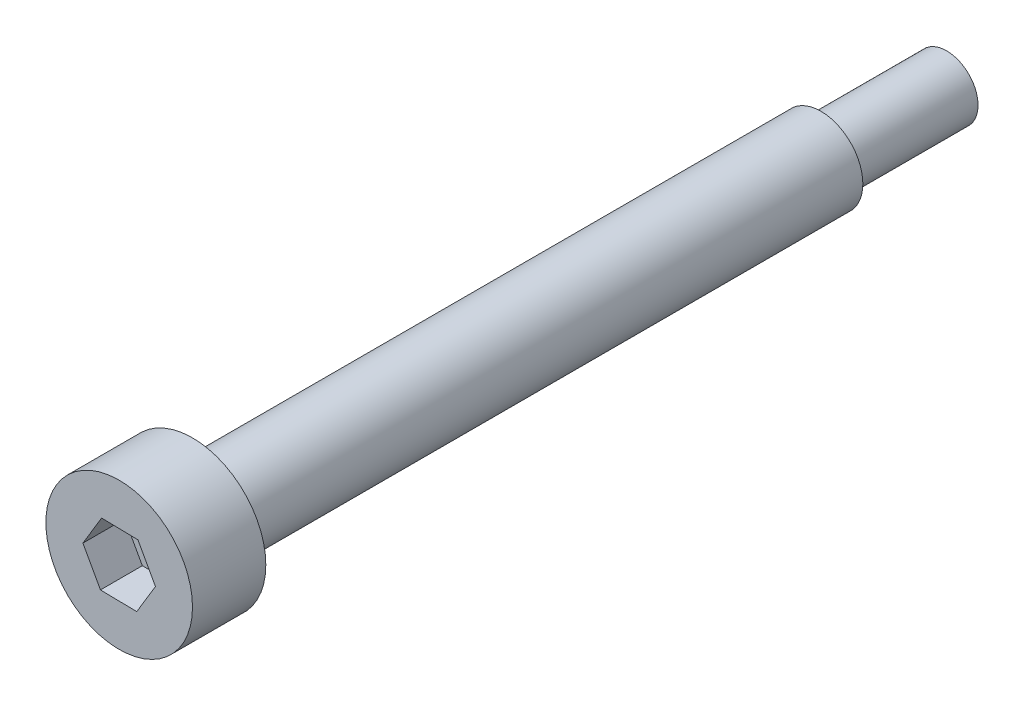
from build123d import *

# Parameters (mm, degrees)
SKETCH_1_R          = 3.5
EXTRUDE_1_DEPTH     = 3.5
CUT_EXTRUDE_1_DEPTH = 2
SKETCH_3_R          = 2
EXTRUDE_2_DEPTH     = 30
SKETCH_4_R          = 1.5
EXTRUDE_3_DEPTH     = 6


with BuildPart() as part:
    # 草图1 → 凸台-拉伸1 (new body)
    with BuildSketch(Plane.XY):
        Circle(SKETCH_1_R)
    extrude(amount=EXTRUDE_1_DEPTH)

    # 草图2 → 切除-拉伸1 (cut)
    with BuildSketch(Plane.XY.offset(3.5)):
        Polygon((0.893639487, 1.483714416), (-0.838114632, 1.515771705), (-1.731754119, 0.03205729), (-0.893639487, -1.483714416), (0.838114632, -1.515771705), (1.731754119, -0.03205729), align=None)
    extrude(amount=-CUT_EXTRUDE_1_DEPTH, mode=Mode.SUBTRACT)

    # 草图3 → 凸台-拉伸2 (add)
    with BuildSketch(Plane(origin=(0, 0, 0), x_dir=(-1, 0, 0), z_dir=(0, 0, -1))):
        with Locations(Location((0, 0, 0), (0, 0, 180))):
            Circle(SKETCH_3_R)
    extrude(amount=EXTRUDE_2_DEPTH)

    # 草图4 → 凸台-拉伸3 (add)
    with BuildSketch(Plane(origin=(0, 0, -30), x_dir=(-1, 0, 0), z_dir=(0, 0, -1))):
        Circle(SKETCH_4_R)
    extrude(amount=EXTRUDE_3_DEPTH)


solid = part.part
